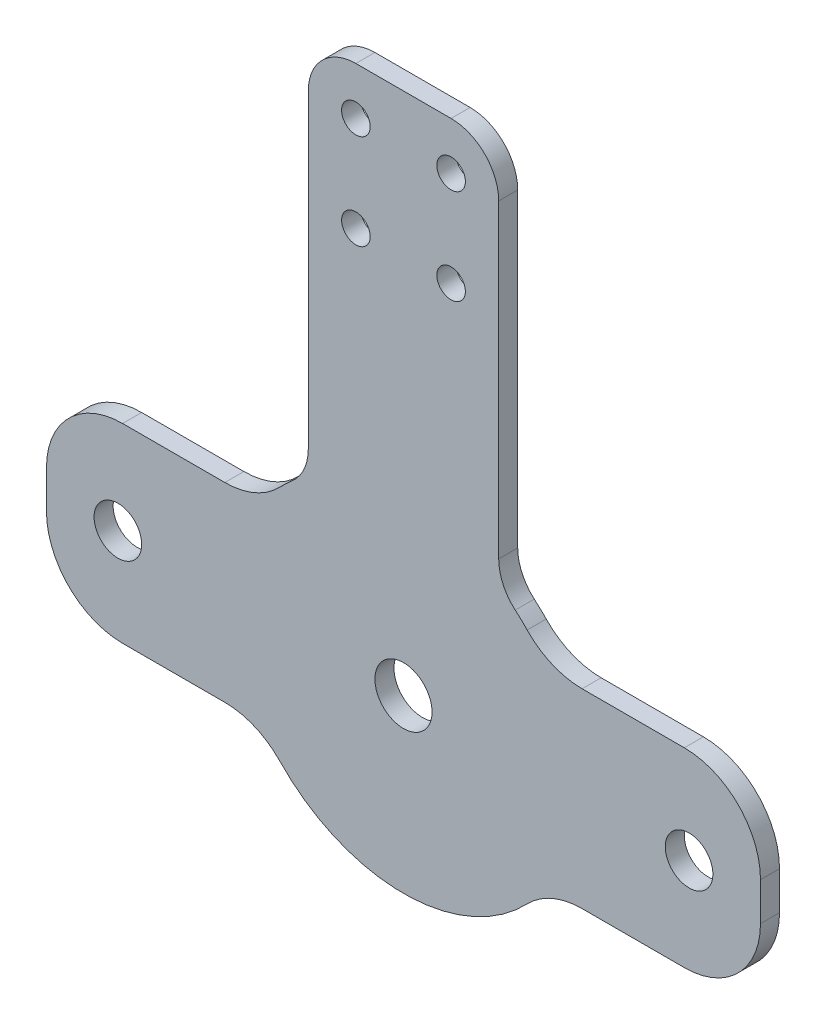
from build123d import *

# Parameters (mm, degrees)
SKETCH_1_R      = 18
SKETCH_1_R_2    = 3
EXTRUDE_1_DEPTH = 2
SKETCH_2_W      = 22.533370453
SKETCH_2_H      = 20
SKETCH_2_R      = 2.5
EXTRUDE_2_DEPTH = 2
SKETCH_3_W      = 20
SKETCH_3_H      = 45
SKETCH_3_R      = 1.5
EXTRUDE_3_DEPTH = 2
FILLET_1_R      = 5
FILLET_2_R      = 8


with BuildPart() as part:
    # 草图1 → 凸台-拉伸1 (new body)
    with BuildSketch(Plane.XY):
        Circle(SKETCH_1_R)
        Circle(SKETCH_1_R_2, mode=Mode.SUBTRACT)
    extrude(amount=EXTRUDE_1_DEPTH)

    # 草图2 → 凸台-拉伸2 (add)
    # profile 1 of 2: a face of its own
    with BuildSketch(Plane.XY.offset(2)):
        with Locations((-26.233314773, 0)):
            Rectangle(SKETCH_2_W, SKETCH_2_H)
        with Locations((-30, 0)):
            Circle(SKETCH_2_R, mode=Mode.SUBTRACT)
    # profile 2 of 2: a face of its own
    with BuildSketch(Plane.XY.offset(2)):
        with Locations((26.233314773, 0)):
            Rectangle(SKETCH_2_W, SKETCH_2_H)
        with Locations((30, 0)):
            Circle(SKETCH_2_R, mode=Mode.SUBTRACT)
    extrude(amount=-EXTRUDE_2_DEPTH)

    # 草图3 → 凸台-拉伸3 (add)
    with BuildSketch(Plane.XY.offset(2)):
        with Locations((0, 32.5)):
            Rectangle(SKETCH_3_W, SKETCH_3_H)
        with Locations((-5, 50)):
            Circle(SKETCH_3_R, mode=Mode.SUBTRACT)
        with Locations((-5, 40)):
            Circle(SKETCH_3_R, mode=Mode.SUBTRACT)
        with Locations((5, 40)):
            Circle(SKETCH_3_R, mode=Mode.SUBTRACT)
        with Locations((5, 50)):
            Circle(SKETCH_3_R, mode=Mode.SUBTRACT)
    extrude(amount=-EXTRUDE_3_DEPTH)

    # 圆角1
    fillet_1_edges = [part.edges().sort_by_distance(p)[0] for p in [
        (-10, 14.966629547, 1),
        (10, 14.966629547, 1),
        (10, 55, 1),
        (-10, 55, 1),
    ]]
    fillet(fillet_1_edges, radius=FILLET_1_R)

    # 圆角2
    fillet_2_edges = [part.edges().sort_by_distance(p)[0] for p in [
        (37.5, -10, 1),
        (14.966629547, -10, 1),
        (14.966629547, 10, 1),
        (37.5, 10, 1),
        (-37.5, 10, 1),
        (-14.966629547, 10, 1),
        (-14.966629547, -10, 1),
        (-37.5, -10, 1),
    ]]
    fillet(fillet_2_edges, radius=FILLET_2_R)


solid = part.part
